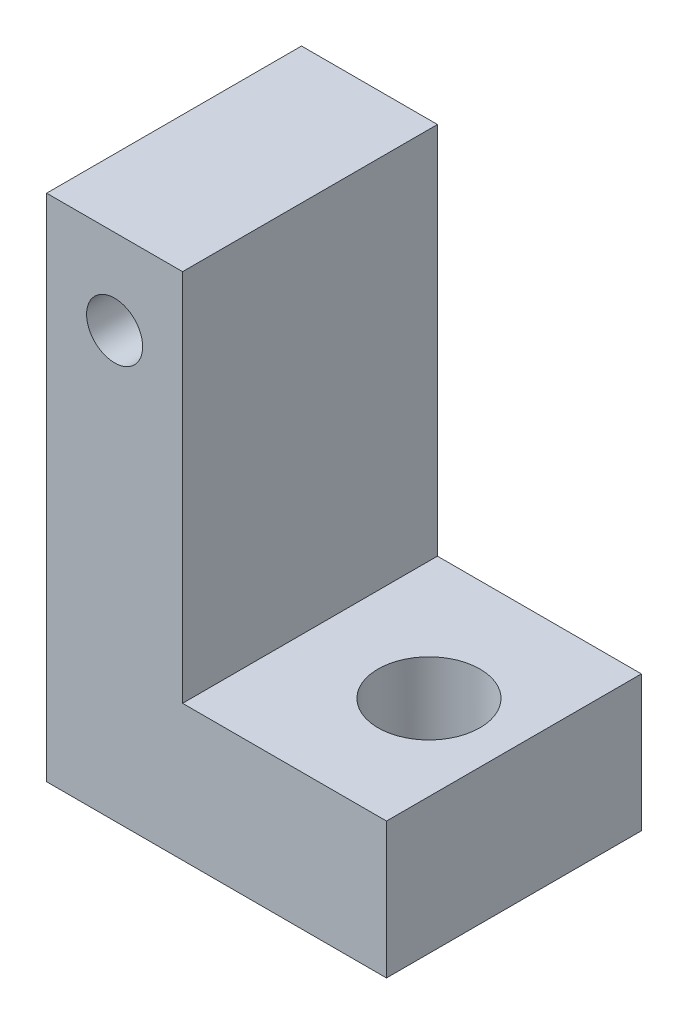
from build123d import *

# Parameters (mm, degrees)
ESTRUSIONE_ESTRUSIONE1_DEPTH = 15
SCHIZZO2_R                   = 3
TAGLIO_ESTRUSIONE1_DEPTH     = 15
FORO_FILETTATO_M4_1_D        = 3.3


with BuildPart() as part:
    # Schizzo1 → Estrusione-Estrusione1 (new body)
    with BuildSketch(Plane.XY):
        Polygon((0, 0), (-20, 0), (-20, 30), (-12, 30), (-12, 8), (0, 8), align=None)
    extrude(amount=ESTRUSIONE_ESTRUSIONE1_DEPTH)

    # Schizzo2 → Taglio-Estrusione1 (cut)
    with BuildSketch(Plane.XZ):
        with Locations((-5, 7.5)):
            Circle(SCHIZZO2_R)
    extrude(amount=-TAGLIO_ESTRUSIONE1_DEPTH, mode=Mode.SUBTRACT)

    # Foro filettato M4-1 (through all)
    with Locations(Plane.XY.offset(15)):
        with Locations((-16, 25)):
            Hole(FORO_FILETTATO_M4_1_D / 2)


solid = part.part
